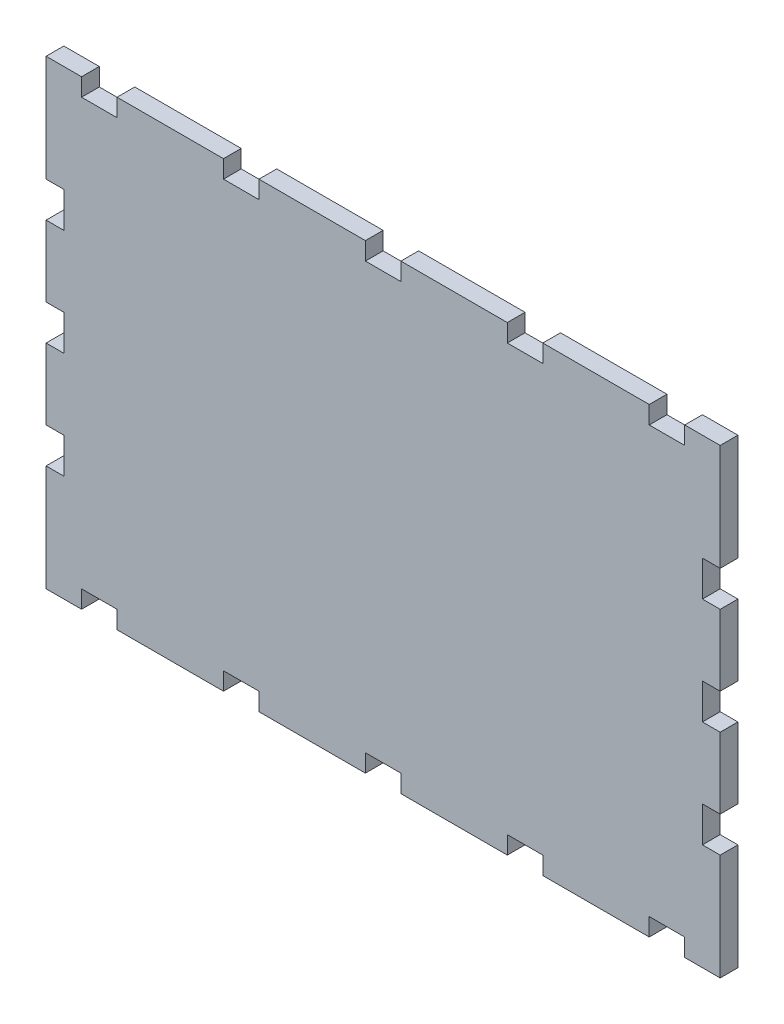
from build123d import *

# Parameters (mm, degrees)
BOSS_EXTRUDE1_DEPTH = 5


with BuildPart() as part:
    # Sketch1 → Boss-Extrude1 (new body)
    with BuildSketch(Plane.XY):
        Polygon((-85, 65), (-85, 60), (-75, 60), (-75, 65), (-45, 65), (-45, 60), (-35, 60), (-35, 65), (-5, 65), (-5, 60), (5, 60), (5, 65), (35, 65), (35, 60), (45, 60), (45, 65), (75, 65), (75, 60), (85, 60), (85, 65), (95, 65), (95, 35), (90, 35), (90, 25), (95, 25), (95, 5), (90, 5), (90, -5), (95, -5), (95, -25), (90, -25), (90, -35), (95, -35), (95, -65), (85, -65), (85, -60), (75, -60), (75, -65), (45, -65), (45, -60), (35, -60), (35, -65), (5, -65), (5, -60), (-5, -60), (-5, -65), (-35, -65), (-35, -60), (-45, -60), (-45, -65), (-75, -65), (-75, -60), (-85, -60), (-85, -65), (-95, -65), (-95, -35), (-90, -35), (-90, -25), (-95, -25), (-95, -5), (-90, -5), (-90, 5), (-95, 5), (-95, 25), (-90, 25), (-90, 35), (-95, 35), (-95, 65), align=None)
    extrude(amount=BOSS_EXTRUDE1_DEPTH)


solid = part.part
